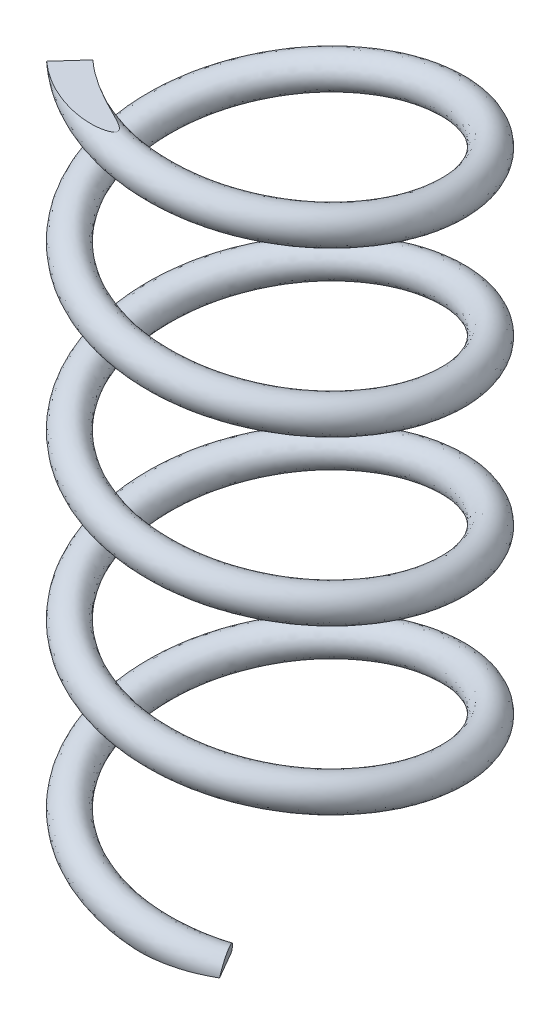
from build123d import *

# Parameters (mm, degrees)
SWEEP1_PITCH             = 5
SWEEP1_HEIGHT            = 21
SWEEP1_RADIUS            = 4.55
SWEEP1_START_ANGLE       = 30
SWEEP1_PROFILE_R         = 0.5
SCHIZZO12_W              = 4.966822224
SCHIZZO12_H              = 2.473167551
TAGLIO_ESTRUSIONE3_DEPTH = 1
SCHIZZO20_W              = 4.41140994
SCHIZZO20_H              = 3.439944213
TAGLIO_ESTRUSIONE2_DEPTH = 1


with BuildPart() as part:
    # Sweep1: sweep along a helix
    with BuildLine() as sweep1_path:
        add(Helix(SWEEP1_PITCH, SWEEP1_HEIGHT, SWEEP1_RADIUS, center=(0, 0, 0), direction=(0, 1, 0), lefthand=True, mode=Mode.PRIVATE).rotate(Axis((0, 0, 0), (0, 1, 0)), SWEEP1_START_ANGLE))
    # Sweep1 profile (on start of the path) → Sweep1 (sweep)
    with BuildSketch(Plane(origin=(2.275, 0, 3.940415587), x_dir=(-0.5000000000002642, 0, -0.8660254037842862), z_dir=(-0.8530765346776942, 0.17228049215176394, 0.4925239669358668))):
        Circle(SWEEP1_PROFILE_R)
    sweep(path=sweep1_path.line, is_frenet=True)

    # Schizzo12 → Taglio-Estrusione3 (cut)
    with BuildSketch(Plane(origin=(0, 0, 0), x_dir=(1, 0, 0), z_dir=(0, 1, 0))):
        with Locations((0.05248179, -4.220637208)):
            Rectangle(SCHIZZO12_W, SCHIZZO12_H)
    extrude(amount=-TAGLIO_ESTRUSIONE3_DEPTH, mode=Mode.SUBTRACT)

    # Schizzo20 → Taglio-Estrusione2 (cut)
    with BuildSketch(Plane(origin=(0, 21, 0), x_dir=(1, 0, 0), z_dir=(0, 1, 0))):
        with Locations((-1.93496862, -4.291967432)):
            Rectangle(SCHIZZO20_W, SCHIZZO20_H)
    extrude(amount=TAGLIO_ESTRUSIONE2_DEPTH, mode=Mode.SUBTRACT)


solid = part.part
